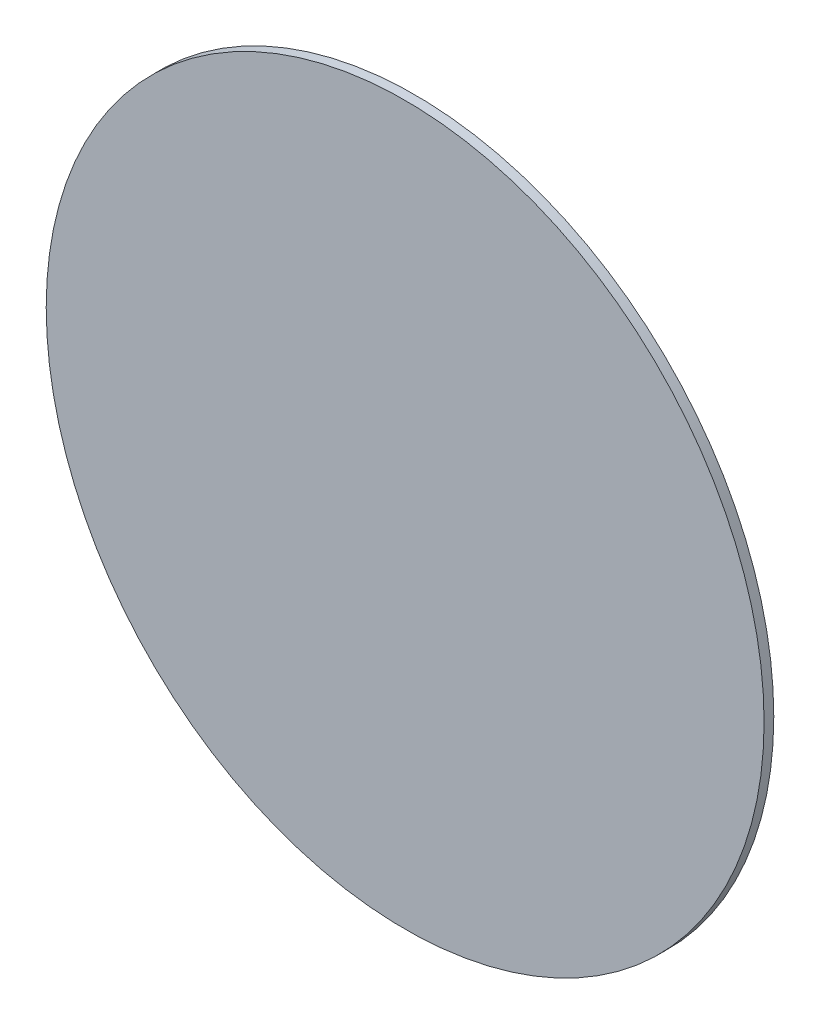
from build123d import *

# Parameters (mm, degrees)
SKETCH1_R           = 37
BOSS_EXTRUDE1_DEPTH = 1


with BuildPart() as part:
    # Sketch1 → Boss-Extrude1 (new body)
    with BuildSketch(Plane.XY):
        Circle(SKETCH1_R)
    extrude(amount=BOSS_EXTRUDE1_DEPTH)


solid = part.part
